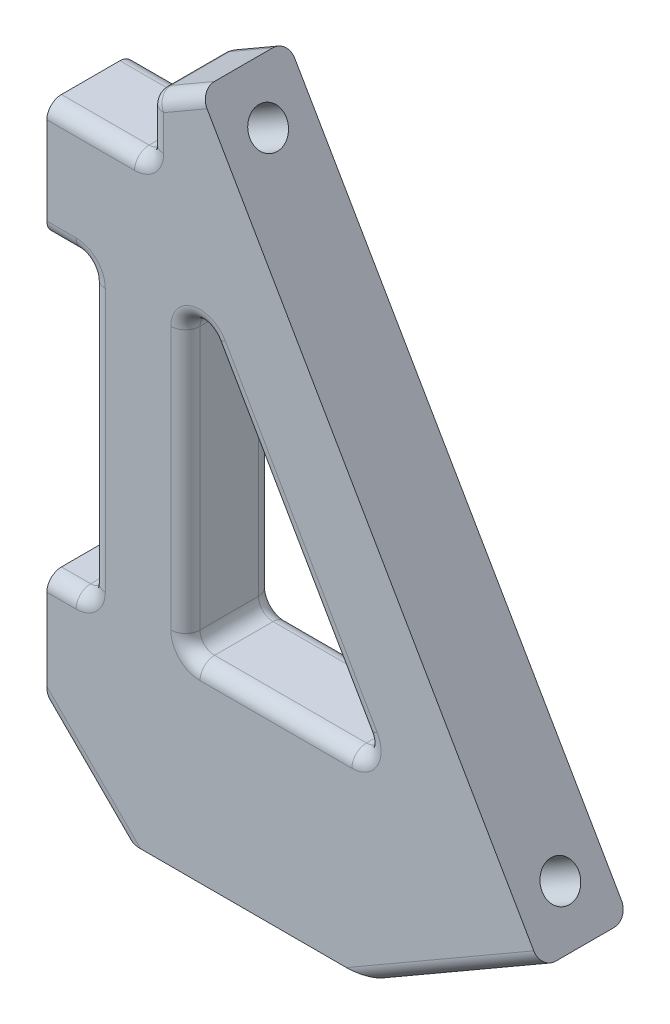
from build123d import *

# Parameters (mm, degrees)
EXTRUDE_1_DEPTH     = 6
CUT_EXTRUDE_1_DEPTH = 6
SKETCH_3_R          = 1.25
CUT_EXTRUDE_2_DEPTH = 8
SKETCH_4_R          = 1.25
CUT_EXTRUDE_3_DEPTH = 8
SKETCH_5_R          = 1.25
CUT_EXTRUDE_4_DEPTH = 4
FILLET_2_R          = 1


with BuildPart() as part:
    # Эскиз1 → Бобышка-Вытянуть1 (new body)
    with BuildSketch(Plane.XY):
        Polygon((0, 5), (5, 0), (22.5, 0), (33.8246732, 6.538303121), (10.464101615, 47), (7, 45), (7, 41), (0, 41), (0, 33), (3, 33), (3, 13), (0, 13), align=None)
    extrude(amount=EXTRUDE_1_DEPTH)

    # Эскиз2 → Вырез-Вытянуть1 (cut)
    with BuildSketch(Plane.XY.offset(6)):
        with BuildLine():
            Line((9.483339502, 32), (9.483339502, 13))
            Line((9.483339502, 13), (20.875644347, 13))
            ThreePointArc((20.875644347, 13), (21.741669751, 13.5), (21.741669751, 14.5))
            Line((21.741669751, 14.5), (11.349364905, 32.5))
            ThreePointArc((11.349364905, 32.5), (10.224520457, 32.965925826), (9.483339502, 32))
        make_face()
    extrude(amount=-CUT_EXTRUDE_1_DEPTH, mode=Mode.SUBTRACT)

    # Эскиз3 → Вырез-Вытянуть2 (cut)
    with BuildSketch(Plane.ZY):
        with Locations(Location((3, 37, 0), (0, 0, 270))):
            Circle(SKETCH_3_R)
        with Locations(Location((3, 9, 0), (0, 0, 270))):
            Circle(SKETCH_3_R)
    extrude(amount=-CUT_EXTRUDE_2_DEPTH, mode=Mode.SUBTRACT)

    # Эскиз4 → Вырез-Вытянуть3 (cut)
    with BuildSketch(Plane.XZ):
        with Locations(Location((13.75, 3, 0), (0, 0, 270))):
            Circle(SKETCH_4_R)
    extrude(amount=-CUT_EXTRUDE_3_DEPTH, mode=Mode.SUBTRACT)

    # Эскиз5 → Вырез-Вытянуть4 (cut)
    with BuildSketch(Plane(origin=(28.1996732, 16.281088913, 0), x_dir=(0, 0, -1), z_dir=(0.8660254037844379, 0.5000000000000014, 0))):
        with Locations(Location((-3, 32.110571585, 0), (0, 0, 90))):
            Circle(SKETCH_5_R)
        with Locations(Location((-3, -7.889428415, 0), (0, 0, 90))):
            Circle(SKETCH_5_R)
    extrude(amount=-CUT_EXTRUDE_4_DEPTH, mode=Mode.SUBTRACT)

    # Скругление2
    fillet_2_edges = [part.edges().sort_by_distance(p)[0] for p in [
        (1.5, 13, 0),
        (3, 23, 0),
        (1.5, 33, 0),
        (3.5, 41, 0),
        (7, 43, 0),
        (28.1623366, 3.26915156, 6),
        (8.732050808, 46, 0),
        (28.1623366, 3.26915156, 0),
        (2.5, 2.5, 0),
        (8.732050808, 46, 6),
        (3, 13, 3),
        (3, 33, 3),
        (7, 41, 3),
        (7, 45, 3),
        (7, 43, 6),
        (3.5, 41, 6),
        (1.5, 33, 6),
        (3, 23, 6),
        (1.5, 13, 6),
        (15.179491924, 13, 0),
        (9.483339502, 22.5, 0),
        (9.483339502, 13, 3),
        (10.224520457, 32.965925826, 0),
        (16.545517328, 23.5, 0),
        (21.741669751, 13.5, 0),
        (15.179491924, 13, 6),
        (21.741669751, 13.5, 6),
        (16.545517328, 23.5, 6),
        (10.224520457, 32.965925826, 6),
        (9.483339502, 22.5, 6),
        (2.5, 2.5, 6),
    ]]
    fillet(fillet_2_edges, radius=FILLET_2_R)


solid = part.part
